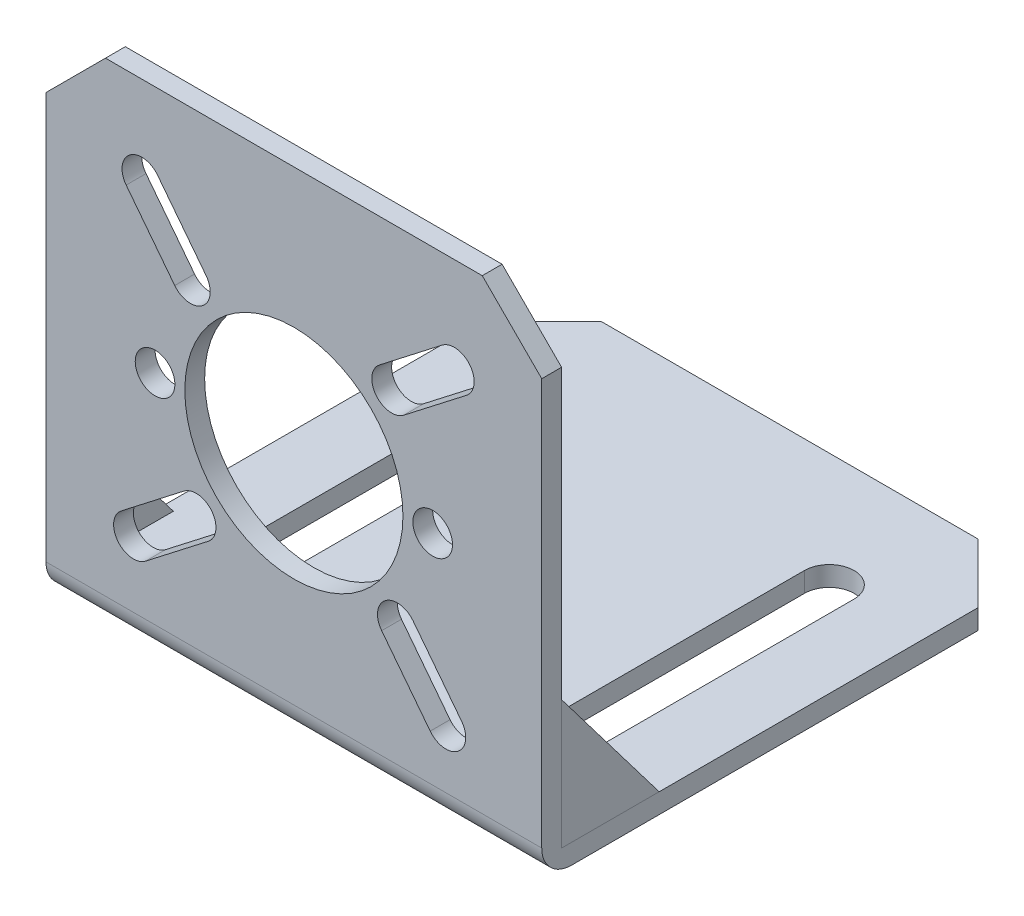
from build123d import *

# Parameters (mm, degrees)
SKETCH1_W           = 50
SKETCH1_H           = 50
BOSS_EXTRUDE1_DEPTH = 2
SKETCH2_R           = 11
CUT_EXTRUDE1_DEPTH  = 36.411862419
CHAMFER1_SIZE       = 6
CHAMFER2_SIZE       = 6
CUT_EXTRUDE2_DEPTH  = 36.411862419
CIRPATTERN1_COUNT   = 4
SKETCH4_R           = 2
CUT_EXTRUDE3_DEPTH  = 36.411862419
SKETCH5_W           = 50
SKETCH5_H           = 2
BOSS_EXTRUDE5_DEPTH = 48
CHAMFER3_SIZE       = 6
CHAMFER4_SIZE       = 6
CUT_EXTRUDE5_DEPTH  = 74.681748079
BOSS_EXTRUDE6_START = -1
BOSS_EXTRUDE6_DEPTH = 1.000012
FILLET1_R           = 3


with BuildPart() as part:
    # Sketch1 → Boss-Extrude1 (new body)
    with BuildSketch(Plane.XY):
        Rectangle(SKETCH1_W, SKETCH1_H)
    extrude(amount=BOSS_EXTRUDE1_DEPTH)

    # Sketch2 → Cut-Extrude1 (cut, through all)
    with BuildSketch(Plane.XY.offset(2)):
        Circle(SKETCH2_R)
    extrude(amount=-CUT_EXTRUDE1_DEPTH, mode=Mode.SUBTRACT)

    # Chamfer1
    chamfer1_edges = [part.edges().sort_by_distance(p)[0] for p in [
        (-25, 25, 1),
    ]]
    chamfer(chamfer1_edges, length=CHAMFER1_SIZE)

    # Chamfer2
    chamfer2_edges = [part.edges().sort_by_distance(p)[0] for p in [
        (25, 25, 1),
    ]]
    chamfer(chamfer2_edges, length=CHAMFER2_SIZE)

    # Sketch3 → Cut-Extrude2 (cut, through all)
    with BuildSketch(Plane.XY.offset(2)):
        with BuildLine():
            Line((8.63247336, 12.016622274), (14.958263021, 16.914007818))
            ThreePointArc((14.958263021, 16.914007818), (17.764056822, 16.556906789), (17.406955793, 13.751112987))
            Line((17.406955793, 13.751112987), (11.081166132, 8.853727444))
            ThreePointArc((11.081166132, 8.853727444), (8.27537233, 9.210828473), (8.63247336, 12.016622274))
        make_face()
    cut_extrude2 = extrude(amount=-CUT_EXTRUDE2_DEPTH, mode=Mode.SUBTRACT)

    # CirPattern1: Cut-Extrude2 ×4 about axis
    cirpattern1_axis = Axis((0, 0, 0), (0, 0, 1))
    for i in range(1, CIRPATTERN1_COUNT):
        add(cut_extrude2.rotate(cirpattern1_axis, i * 360 / CIRPATTERN1_COUNT), mode=Mode.SUBTRACT)

    # Sketch4 → Cut-Extrude3 (cut, through all)
    with BuildSketch(Plane.XY.offset(2)):
        with Locations((14, 0)):
            Circle(SKETCH4_R)
    cut_extrude3 = extrude(amount=-CUT_EXTRUDE3_DEPTH, mode=Mode.SUBTRACT)

    # Mirror5: Cut-Extrude3 across plane
    add(cut_extrude3.mirror(Plane(origin=(0, 0, 0), x_dir=(0, 0, 1), z_dir=(1, 0, 0))), mode=Mode.SUBTRACT)

    # Sketch5 → Boss-Extrude5 (add)
    with BuildSketch(Plane(origin=(0, 0, 0), x_dir=(-1, 0, 0), z_dir=(0, 0, -1))):
        with Locations((0, -24)):
            Rectangle(SKETCH5_W, SKETCH5_H)
    extrude(amount=BOSS_EXTRUDE5_DEPTH)

    # Chamfer3
    chamfer3_edges = [part.edges().sort_by_distance(p)[0] for p in [
        (25, -24, -48),
    ]]
    chamfer(chamfer3_edges, length=CHAMFER3_SIZE)

    # Chamfer4
    chamfer4_edges = [part.edges().sort_by_distance(p)[0] for p in [
        (-25, -24, -48),
    ]]
    chamfer(chamfer4_edges, length=CHAMFER4_SIZE)

    # Sketch7 → Cut-Extrude5 (cut, through all)
    with BuildSketch(Plane.XZ.offset(25)):
        with BuildLine():
            Line((-13, -7.5), (-13, -36.5))
            ThreePointArc((-13, -36.5), (-15.5, -39), (-18, -36.5))
            Line((-18, -36.5), (-18, -7.5))
            ThreePointArc((-18, -7.5), (-15.5, -5), (-13, -7.5))
        make_face()
    cut_extrude5 = extrude(amount=-CUT_EXTRUDE5_DEPTH, mode=Mode.SUBTRACT)

    # Mirror8: Cut-Extrude5 across plane
    add(cut_extrude5.mirror(Plane(origin=(0, 0, 0), x_dir=(0, 0, 1), z_dir=(1, 0, 0))), mode=Mode.SUBTRACT)

    # Sketch8 → Boss-Extrude6 (add)
    with BuildSketch(Plane(origin=(25, 0, 0), x_dir=(0, 0, -1), z_dir=(1, 0, 0)).offset(BOSS_EXTRUDE6_START)):
        Polygon((0, -10.038318293), (9.843932034, -23), (0, -23), align=None)
    boss_extrude6 = extrude(amount=BOSS_EXTRUDE6_DEPTH)

    # Mirror9: Boss-Extrude6 across plane
    add(boss_extrude6.mirror(Plane(origin=(0, 0, 0), x_dir=(0, 0, 1), z_dir=(1, 0, 0))))

    # Fillet1
    fillet1_edges = [part.edges().sort_by_distance(p)[0] for p in [
        (0, -25, 2),
    ]]
    fillet(fillet1_edges, radius=FILLET1_R)


solid = part.part
